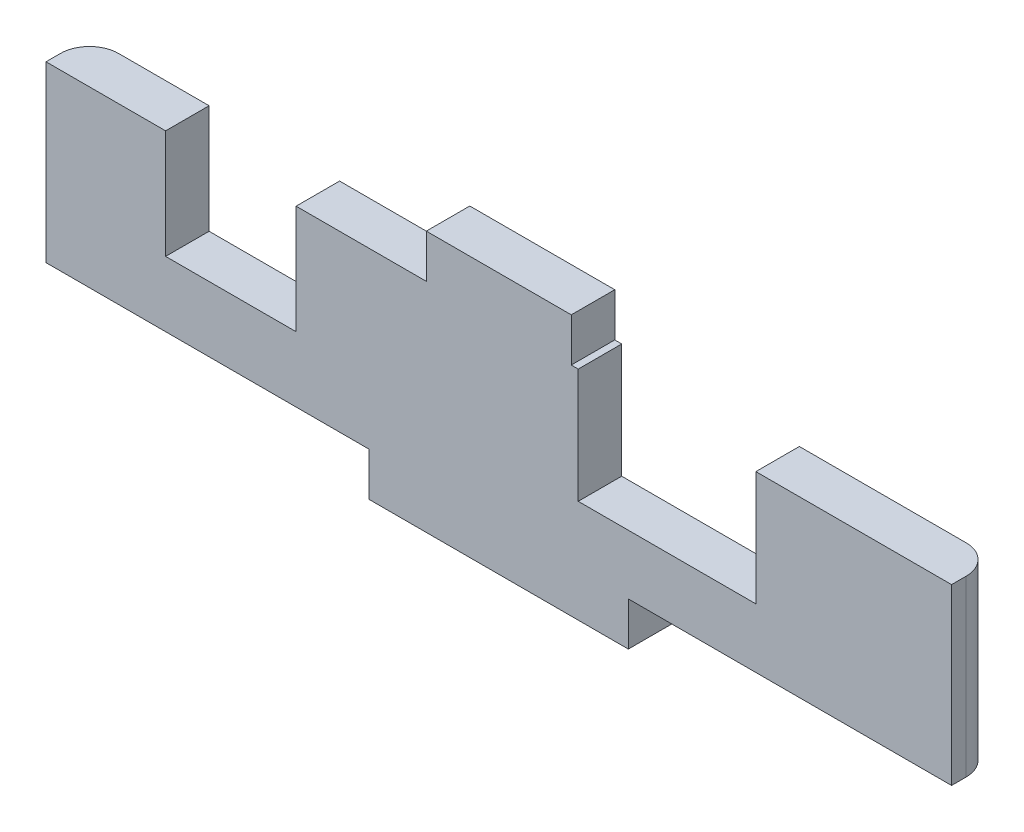
from build123d import *

# Parameters (mm, degrees)
SKETCH1_W           = 62.46
SKETCH1_H           = 18
BOSS_EXTRUDE1_DEPTH = 3
SKETCH2_W           = 22.295
SKETCH2_H           = 3
CUT_EXTRUDE1_DEPTH  = 3
SKETCH3_W           = 12.25
SKETCH3_H           = 10.9
SKETCH3_W_2         = 9
SKETCH3_H_2         = 10.5
CUT_EXTRUDE2_DEPTH  = 3
SKETCH5_W           = 26.23
SKETCH5_H           = 3
CUT_EXTRUDE3_DEPTH  = 3
FILLET1_R           = 2
FILLET2_R           = 2


with BuildPart() as part:
    # Sketch1 → Boss-Extrude1 (new body)
    with BuildSketch(Plane.XY):
        Rectangle(SKETCH1_W, SKETCH1_H)
    extrude(amount=BOSS_EXTRUDE1_DEPTH)

    # Sketch2 → Cut-Extrude1 (cut)
    with BuildSketch(Plane.XY.offset(3)):
        with Locations((20.0825, -7.5)):
            Rectangle(SKETCH2_W, SKETCH2_H)
        with Locations((-20.0825, -7.5)):
            Rectangle(SKETCH2_W, SKETCH2_H)
    extrude(amount=-CUT_EXTRUDE1_DEPTH, mode=Mode.SUBTRACT)

    # Sketch3 → Cut-Extrude2 (cut)
    with BuildSketch(Plane.XY.offset(3)):
        with Locations((11.605, 3.55)):
            Rectangle(SKETCH3_W, SKETCH3_H)
        with Locations((-18.48, 3.75)):
            Rectangle(SKETCH3_W_2, SKETCH3_H_2)
    extrude(amount=-CUT_EXTRUDE2_DEPTH, mode=Mode.SUBTRACT)

    # Sketch5 → Cut-Extrude3 (cut)
    with BuildSketch(Plane(origin=(0, 0, 0), x_dir=(-1, 0, 0), z_dir=(0, 0, -1))):
        with Locations((18.115, 7.5)):
            Rectangle(SKETCH5_W, SKETCH5_H)
        with Locations((-18.115, 7.5)):
            Rectangle(SKETCH5_W, SKETCH5_H)
    extrude(amount=-CUT_EXTRUDE3_DEPTH, mode=Mode.SUBTRACT)

    # Fillet1
    fillet1_edges = [part.edges().sort_by_distance(p)[0] for p in [
        (-31.23, 0, 0),
    ]]
    fillet(fillet1_edges, radius=FILLET1_R)

    # Fillet2
    fillet2_edges = [part.edges().sort_by_distance(p)[0] for p in [
        (31.23, 0, 0),
    ]]
    fillet(fillet2_edges, radius=FILLET2_R)


solid = part.part
